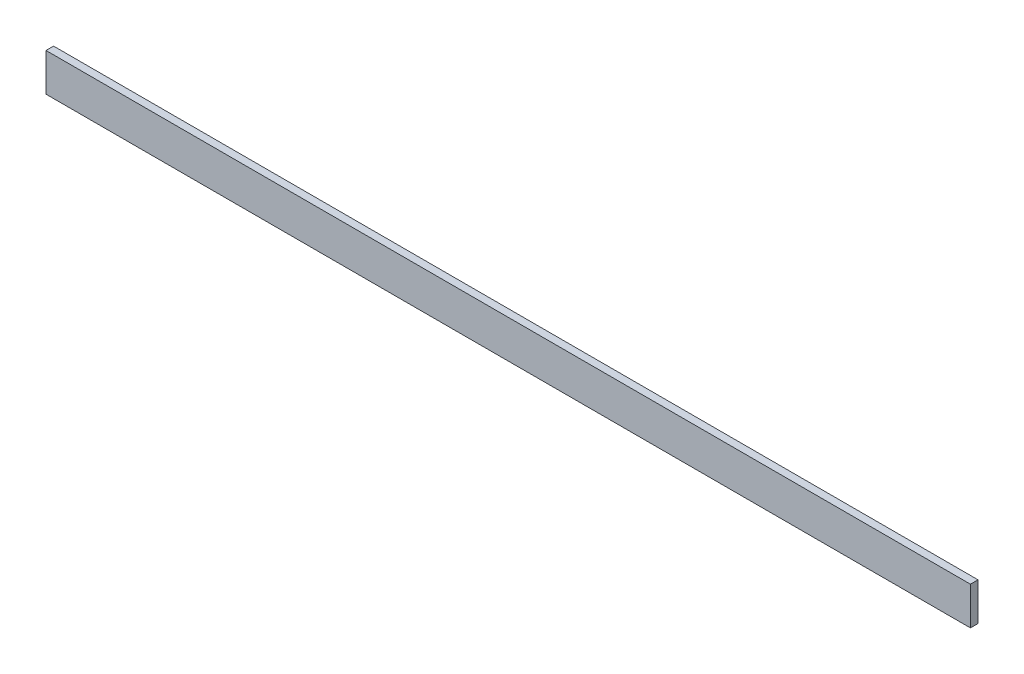
from build123d import *

# Parameters (mm, degrees)
SKETCH1_W           = 610
SKETCH1_H           = 25
BOSS_EXTRUDE1_DEPTH = 5


with BuildPart() as part:
    # Sketch1 → Boss-Extrude1 (new body)
    with BuildSketch(Plane.XY):
        Rectangle(SKETCH1_W, SKETCH1_H)
    extrude(amount=BOSS_EXTRUDE1_DEPTH)


solid = part.part
